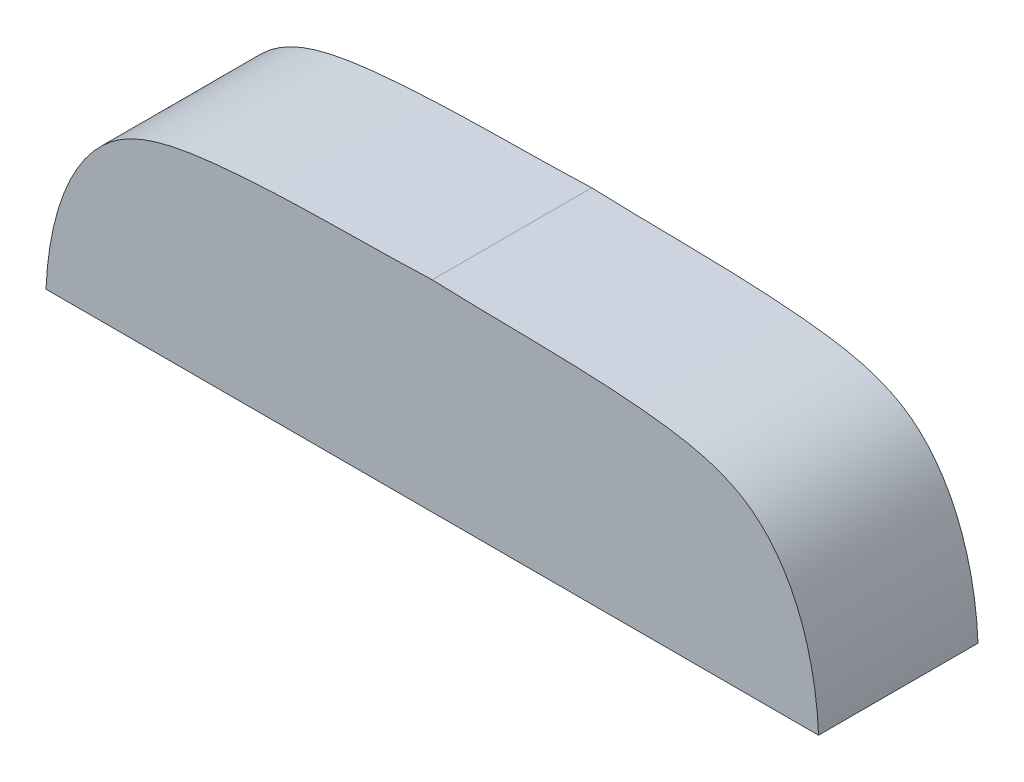
from build123d import *

# Parameters (mm, degrees)
BOSS_EXTRUDE1_DEPTH      = 69.85
BOSS_EXTRUDE1_DEPTH_BACK = 69.85


with BuildPart() as part:
    # Sketch1 → Boss-Extrude1 (new, two sides: drawn at the far end of the back side and taken through both)
    with BuildSketch(Plane.XY.offset(-BOSS_EXTRUDE1_DEPTH_BACK)):
        with BuildLine():
            Line((0, 55.943822519), (-338.420140941, 55.943822519))
            add(Edge.make_bspline(
                [(0, 232.258315543), (-56.542000297, 229.74112864), (-174.485235663, 232.87446935), (-302.766948324, 203.903921333), (-335.826259434, 117.861475814), (-338.420140941, 55.943822519)],
                knots=[0, 0, 0, 0, 0.225226498, 0.337839747, 0.524743478, 0.524743478, 0.524743478, 0.524743478], degree=3))
            add(Edge.make_bspline(
                [(0, 232.258315543), (56.542000297, 229.74112864), (174.485235663, 232.87446935), (302.766948324, 203.903921333), (335.826259434, 117.861475814), (338.420140941, 55.943822519)],
                knots=[0, 0, 0, 0, 0.225226498, 0.337839747, 0.524743478, 0.524743478, 0.524743478, 0.524743478], degree=3))
            Line((338.420140941, 55.943822519), (0, 55.943822519))
        make_face()
    extrude(amount=BOSS_EXTRUDE1_DEPTH + BOSS_EXTRUDE1_DEPTH_BACK)


solid = part.part
